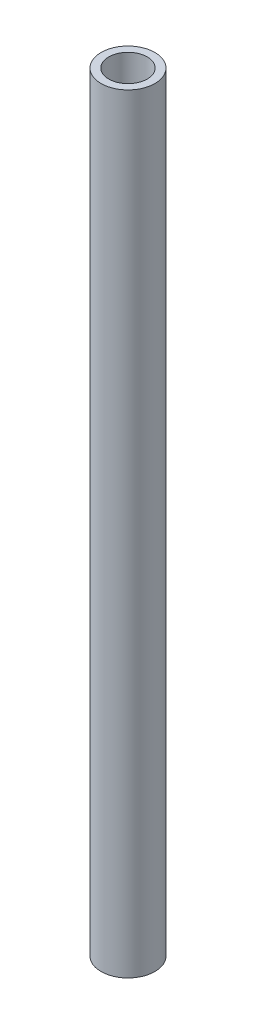
from build123d import *

# Parameters (mm, degrees)
SKETCH1_R           = 13.335
SKETCH1_R_2         = 9.525
BOSS_EXTRUDE1_DEPTH = 381


with BuildPart() as part:
    # Sketch1 → Boss-Extrude1 (new body)
    with BuildSketch(Plane(origin=(0, 0, 0), x_dir=(1, 0, 0), z_dir=(0, 1, 0))):
        with Locations(Location((0, 0, 0), (0, 0, 270))):
            Circle(SKETCH1_R)
        with Locations(Location((0, 0, 0), (0, 0, 270))):
            Circle(SKETCH1_R_2, mode=Mode.SUBTRACT)
    extrude(amount=BOSS_EXTRUDE1_DEPTH)


solid = part.part
